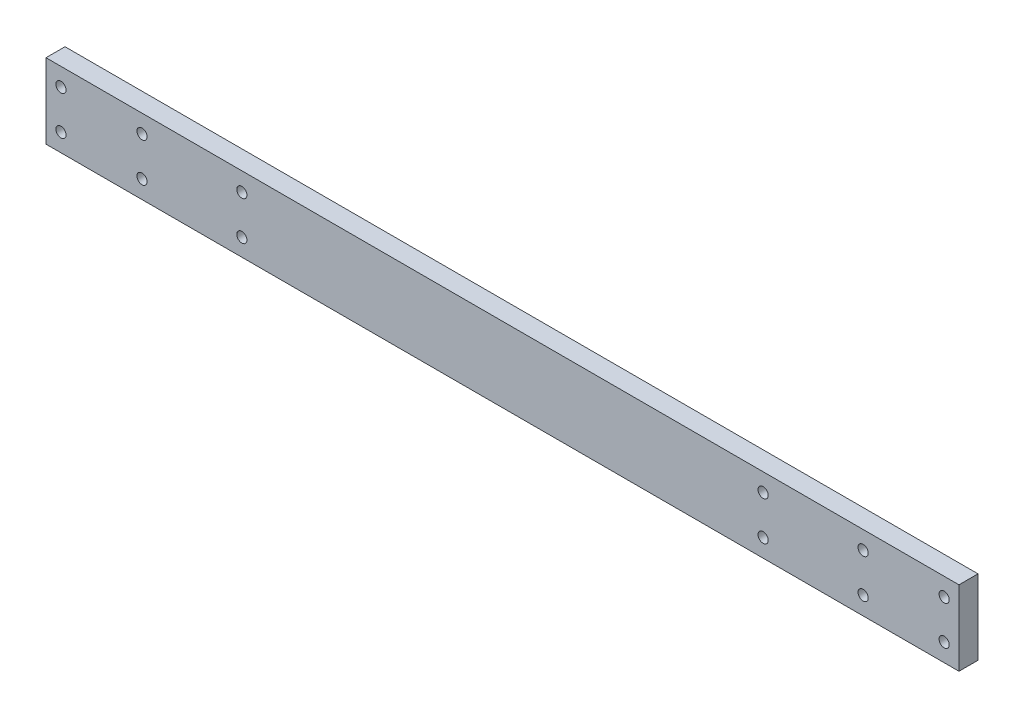
from build123d import *

# Parameters (mm, degrees)
SKETCH1_W           = 304.8
SKETCH1_H           = 25
BOSS_EXTRUDE1_DEPTH = 6.35
SKETCH2_R           = 1.7
CUT_EXTRUDE1_DEPTH  = 10
SKETCH3_R           = 1.7
CUT_EXTRUDE2_DEPTH  = 21


with BuildPart() as part:
    # Sketch1 → Boss-Extrude1 (new body)
    with BuildSketch(Plane.XY):
        with Locations((111.623766163, 223.42362241)):
            Rectangle(SKETCH1_W, SKETCH1_H)
    extrude(amount=BOSS_EXTRUDE1_DEPTH)

    # Sketch2 → Cut-Extrude1 (cut)
    with BuildSketch(Plane.XY.offset(6.35)):
        with Locations((-35.776233837, 216.92362241)):
            Circle(SKETCH2_R)
        with Locations((-8.726233837, 216.92362241)):
            Circle(SKETCH2_R)
        with Locations((-35.776233837, 229.92362241)):
            Circle(SKETCH2_R)
        with Locations((-8.726233837, 229.92362241)):
            Circle(SKETCH2_R)
        with Locations((232.023766163, 216.92362241)):
            Circle(SKETCH2_R)
        with Locations((232.023766163, 229.92362241)):
            Circle(SKETCH2_R)
        with Locations((259.073766163, 216.92362241)):
            Circle(SKETCH2_R)
        with Locations((259.073766163, 229.92362241)):
            Circle(SKETCH2_R)
    extrude(amount=-CUT_EXTRUDE1_DEPTH, mode=Mode.SUBTRACT)

    # Sketch3 → Cut-Extrude2 (cut)
    with BuildSketch(Plane.XY.offset(6.35)):
        with Locations((24.610056088, 229.719330314)):
            Circle(SKETCH3_R)
        with Locations((24.610056088, 216.719330314)):
            Circle(SKETCH3_R)
        with Locations((198.637476239, 216.92362241)):
            Circle(SKETCH3_R)
        with Locations((198.637476239, 229.92362241)):
            Circle(SKETCH3_R)
    extrude(amount=-CUT_EXTRUDE2_DEPTH, mode=Mode.SUBTRACT)


solid = part.part
